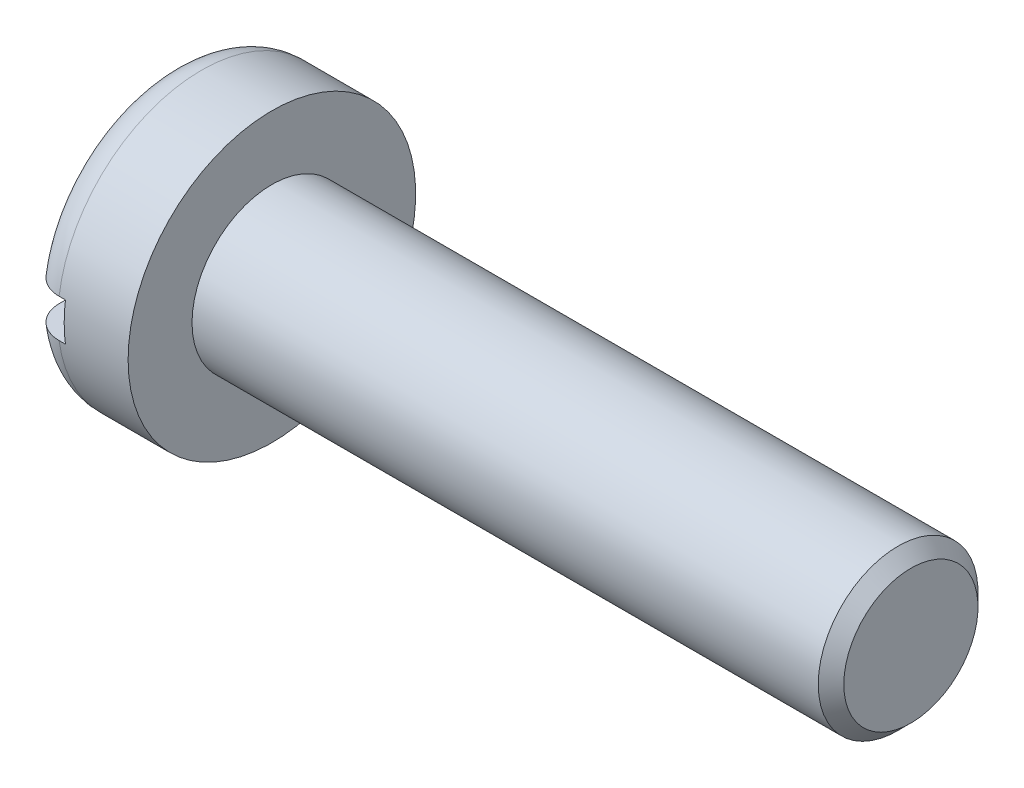
from build123d import *

# Parameters (mm, degrees)
CHANFREIN1_SIZE         = 0.2
CONG_1_R                = 0.5
ESQUISSE3_W             = 0.767853135
ESQUISSE3_H             = 0.6
ENL_V_MAT_EXTRU_1_DEPTH = 5


with BuildPart() as part:
    # Esquisse1 → Base-Révolution (revolve)
    with BuildSketch(Plane.XY, mode=Mode.PRIVATE) as base_r_volution_sk:
        Polygon((-1.6, 0), (-1.6, 2.25), (0, 2.25), (0, 1.25), (10, 1.25), (10, 0), align=None)
    revolve(base_r_volution_sk.sketch.rotate(Axis((-28.982684825, 0, 0), (1, 0, 0)), 90), axis=Axis((-28.982684825, 0, 0), (1, 0, 0)))

    # Chanfrein1
    chanfrein1_edges = [part.edges().sort_by_distance(p)[0] for p in [
        (10, 0, -1.25),
    ]]
    chamfer(chanfrein1_edges, length=CHANFREIN1_SIZE)

    # Congé1
    cong_1_edges = [part.edges().sort_by_distance(p)[0] for p in [
        (-1.6, 0, -2.25),
    ]]
    fillet(cong_1_edges, radius=CONG_1_R)

    # Esquisse3 → Enlèv. mat.-Extru.1 (cut, symmetric)
    with BuildSketch(Plane.XY):
        with Locations((-1.383926568, 0)):
            Rectangle(ESQUISSE3_W, ESQUISSE3_H)
    extrude(amount=ENL_V_MAT_EXTRU_1_DEPTH, both=True, mode=Mode.SUBTRACT)


solid = part.part
